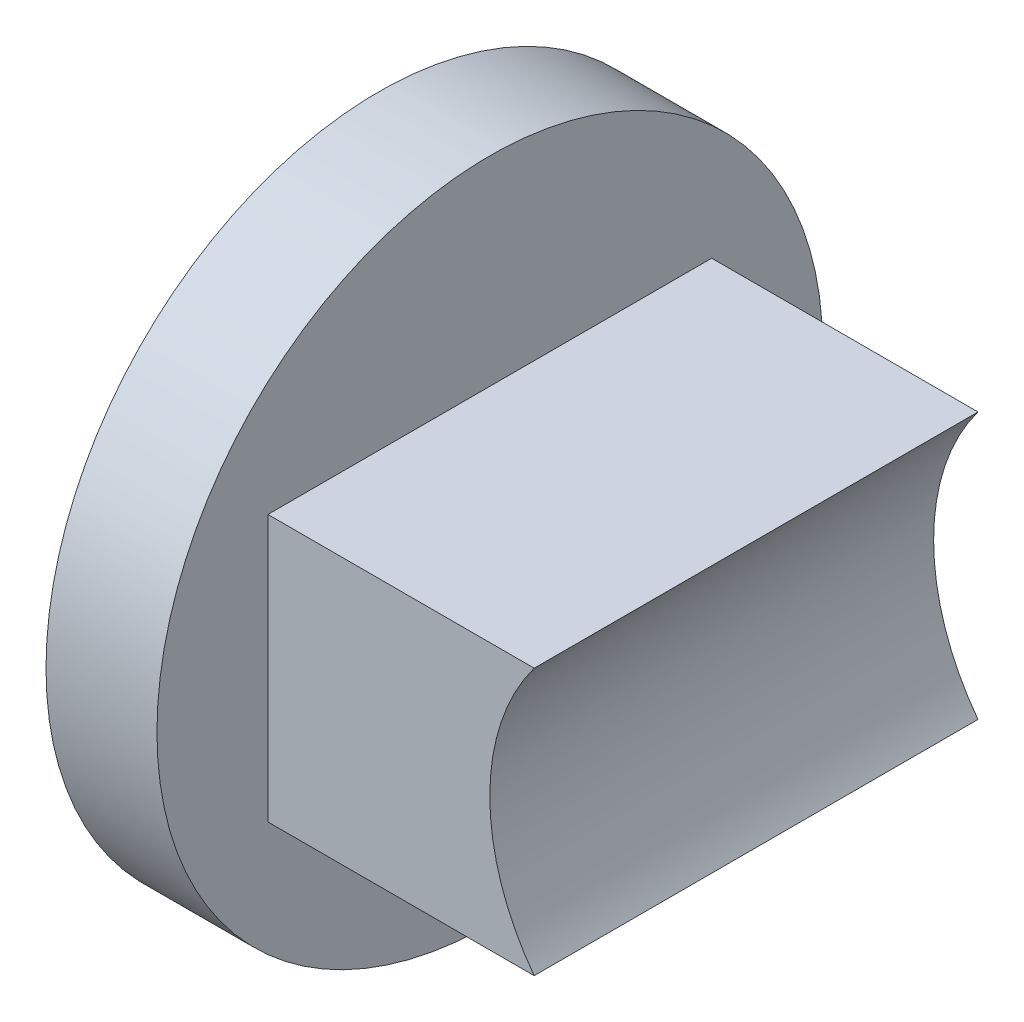
from build123d import *

# Parameters (mm, degrees)
SKETCH_1_R          = 30
SKETCH_1_R_2        = 5
EXTRUDE_1_DEPTH     = 10
SKETCH_3_W          = 40
SKETCH_3_H          = 24
EXTRUDE_2_DEPTH     = 30
SKETCH_4_R          = 20
CUT_EXTRUDE_2_DEPTH = 71.710678119


with BuildPart() as part:
    # 草图1 → 凸台-拉伸1 (new body)
    with BuildSketch(Plane(origin=(0, 0, 0), x_dir=(0, 0, -1), z_dir=(1, 0, 0))):
        Circle(SKETCH_1_R)
        Circle(SKETCH_1_R_2, mode=Mode.SUBTRACT)
    extrude(amount=EXTRUDE_1_DEPTH)

    # 草图3 → 凸台-拉伸2 (add)
    with BuildSketch(Plane(origin=(10, 0, 0), x_dir=(0, 0, -1), z_dir=(1, 0, 0))):
        Rectangle(SKETCH_3_W, SKETCH_3_H)
    extrude(amount=EXTRUDE_2_DEPTH)

    # 草图4 → 切除-拉伸2 (cut, through all)
    with BuildSketch(Plane(origin=(0, 0, -20), x_dir=(-1, 0, 0), z_dir=(0, 0, -1))):
        with Locations((-50, 0)):
            Circle(SKETCH_4_R)
    extrude(amount=-CUT_EXTRUDE_2_DEPTH, mode=Mode.SUBTRACT)


solid = part.part
